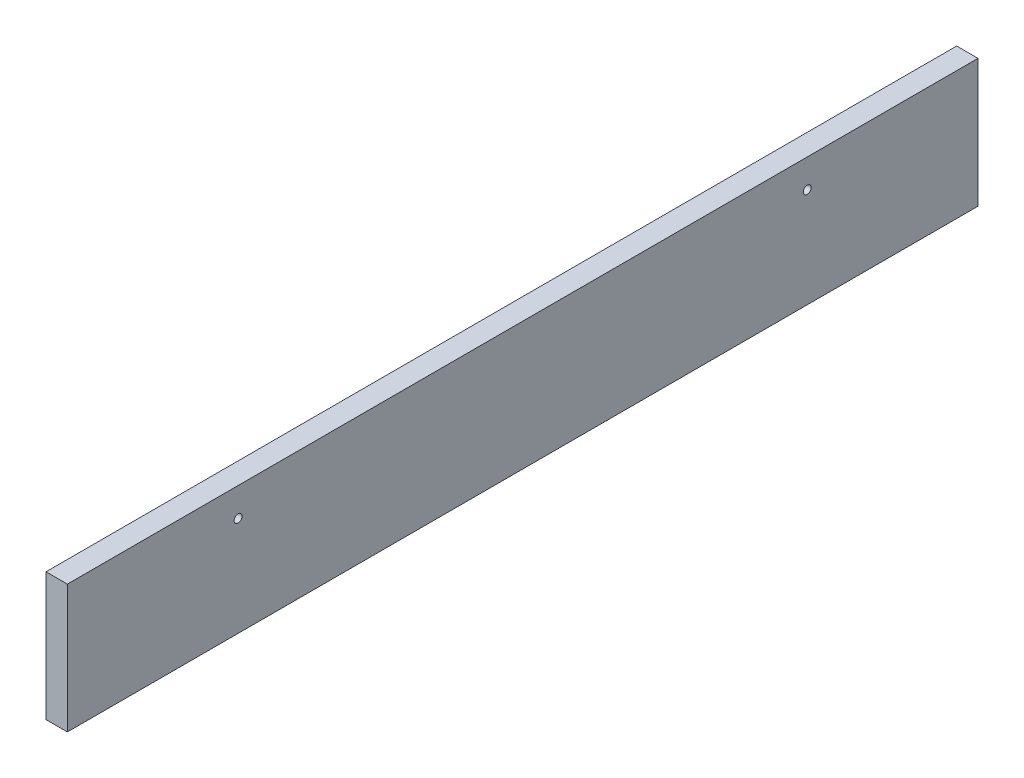
from build123d import *

# Parameters (mm, degrees)
SKETCH1_W           = 19.05
SKETCH1_H           = 114.3
BOSS_EXTRUDE1_DEPTH = 812.8
SKETCH2_R           = 3.556
CUT_EXTRUDE3_DEPTH  = 820.97870131
SKETCH2_6_R         = 3.556
CUT_EXTRUDE4_DEPTH  = 820.97870131


with BuildPart() as part:
    # Sketch1 → Boss-Extrude1 (new body)
    with BuildSketch(Plane.XY):
        with Locations((3.196473841, -49.425457317)):
            Rectangle(SKETCH1_W, SKETCH1_H)
    extrude(amount=BOSS_EXTRUDE1_DEPTH)

    # Sketch2 → Cut-Extrude3 (cut, through all)
    with BuildSketch(Plane.ZY.offset(6.328526159)):
        with Locations((660.4, -17.675457317)):
            Circle(SKETCH2_R)
    extrude(amount=-CUT_EXTRUDE3_DEPTH, mode=Mode.SUBTRACT)

    # Sketch2<6> → Cut-Extrude4 (cut, through all)
    with BuildSketch(Plane.ZY.offset(6.328526159)):
        with Locations((152.4, -17.675457317)):
            Circle(SKETCH2_6_R)
    extrude(amount=-CUT_EXTRUDE4_DEPTH, mode=Mode.SUBTRACT)


solid = part.part
